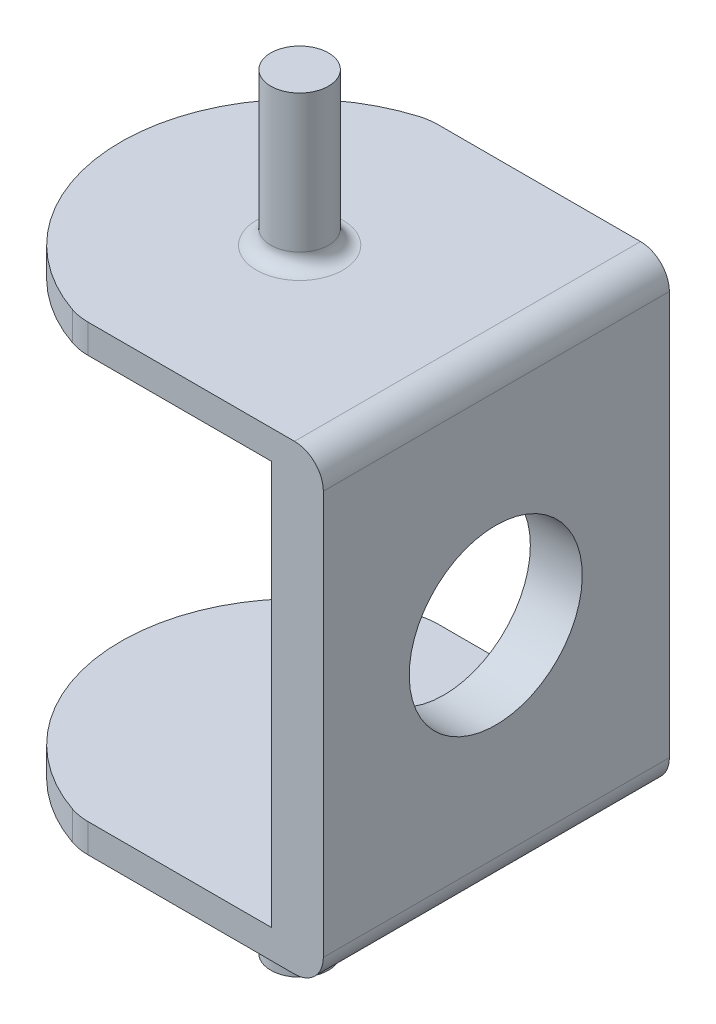
from build123d import *

# Parameters (mm, degrees)
SWEEP1_PROFILE_R    = 10
SKETCH8_R           = 10
BOSS_EXTRUDE1_DEPTH = 0.25
BOSS_EXTRUDE2_DEPTH = 10
BOSS_EXTRUDE5_DEPTH = 120
SKETCH15_W          = 120
SKETCH15_H          = 140
CUT_EXTRUDE2_DEPTH  = 95
FILLET1_R           = 5
FILLET3_R           = 20
FILLET4_R           = 10
SKETCH16_R          = 30
CUT_EXTRUDE3_DEPTH  = 18


with BuildPart() as part:
    # Sweep1: sweep along a path in Sketch1
    with BuildLine(Plane.XY) as sweep1_path:
        Line((0, 132.640900072), (0, -132.640900072))
    # Sweep1 profile (on start of the path) → Sweep1 (sweep)
    with BuildSketch(Plane(origin=(0, 132.640900072, 0), x_dir=(-1, 0, 0), z_dir=(0, -1, 0))):
        Circle(SWEEP1_PROFILE_R)
    sweep(path=sweep1_path.line)

    # Sketch8 → Boss-Extrude1 (add)
    with BuildSketch(Plane(origin=(0, 132.640900072, 0), x_dir=(1, 0, 0), z_dir=(0, 1, 0))):
        Circle(SKETCH8_R)
    extrude(amount=BOSS_EXTRUDE1_DEPTH)

    # Sketch9 → Boss-Extrude2 (add)
    with BuildSketch(Plane(origin=(0, 80.125, 0), x_dir=(1, 0, 0), z_dir=(0, 1, 0))):
        with BuildLine():
            Line((60, -59.786486662), (-16.583123952, -59.786486662))
            ThreePointArc((-16.583123952, -59.786486662), (-62.038041158, 0.839902741), (-14.958502558, 60.213513338))
            Line((-14.958502558, 60.213513338), (60, 60.213513338))
            Line((60, 60.213513338), (60, -59.786486662))
        make_face()
    boss_extrude2 = extrude(amount=-BOSS_EXTRUDE2_DEPTH)

    # Mirror1: Boss-Extrude2 across plane
    add(boss_extrude2.mirror(Plane.ZX.offset(0.125)))

    # Sketch14 → Boss-Extrude5 (add)
    with BuildSketch(Plane.XY.offset(59.786486662)):
        Polygon((50, 70.125), (60, 70.125), (60, 80.125), (68, 80.125), (68, -79.875), (60, -79.875), (60, -69.875), (50, -69.875), align=None)
    extrude(amount=-BOSS_EXTRUDE5_DEPTH)

    # Sketch15 → Cut-Extrude2 (cut)
    with BuildSketch(Plane.ZY.offset(-50)):
        with Locations((-0.213513338, 0.125)):
            Rectangle(SKETCH15_W, SKETCH15_H)
    extrude(amount=CUT_EXTRUDE2_DEPTH, mode=Mode.SUBTRACT)

    # Fillet1
    fillet1_edges = [part.edges().sort_by_distance(p)[0] for p in [
        (10, 80.125, 0),
        (10, -79.875, 0),
    ]]
    fillet(fillet1_edges, radius=FILLET1_R)

    # Fillet3
    fillet3_edges = [part.edges().sort_by_distance(p)[0] for p in [
        (-16.583123952, 75.125, 59.786486662),
        (-14.958502558, 75.125, -60.213513338),
        (-14.958502558, -74.875, -60.213513338),
        (-16.583123952, -74.875, 59.786486662),
    ]]
    fillet(fillet3_edges, radius=FILLET3_R)

    # Fillet4
    fillet4_edges = [part.edges().sort_by_distance(p)[0] for p in [
        (68, 80.125, -0.213513338),
        (68, -79.875, -0.213513338),
    ]]
    fillet(fillet4_edges, radius=FILLET4_R)

    # Sketch16 → Cut-Extrude3 (cut)
    with BuildSketch(Plane(origin=(68, 0, 0), x_dir=(0, 0, -1), z_dir=(1, 0, 0))):
        with Locations(Location((0, 0, 0), (0, 0, 90))):
            Circle(SKETCH16_R)
    extrude(amount=-CUT_EXTRUDE3_DEPTH, mode=Mode.SUBTRACT)


solid = part.part
